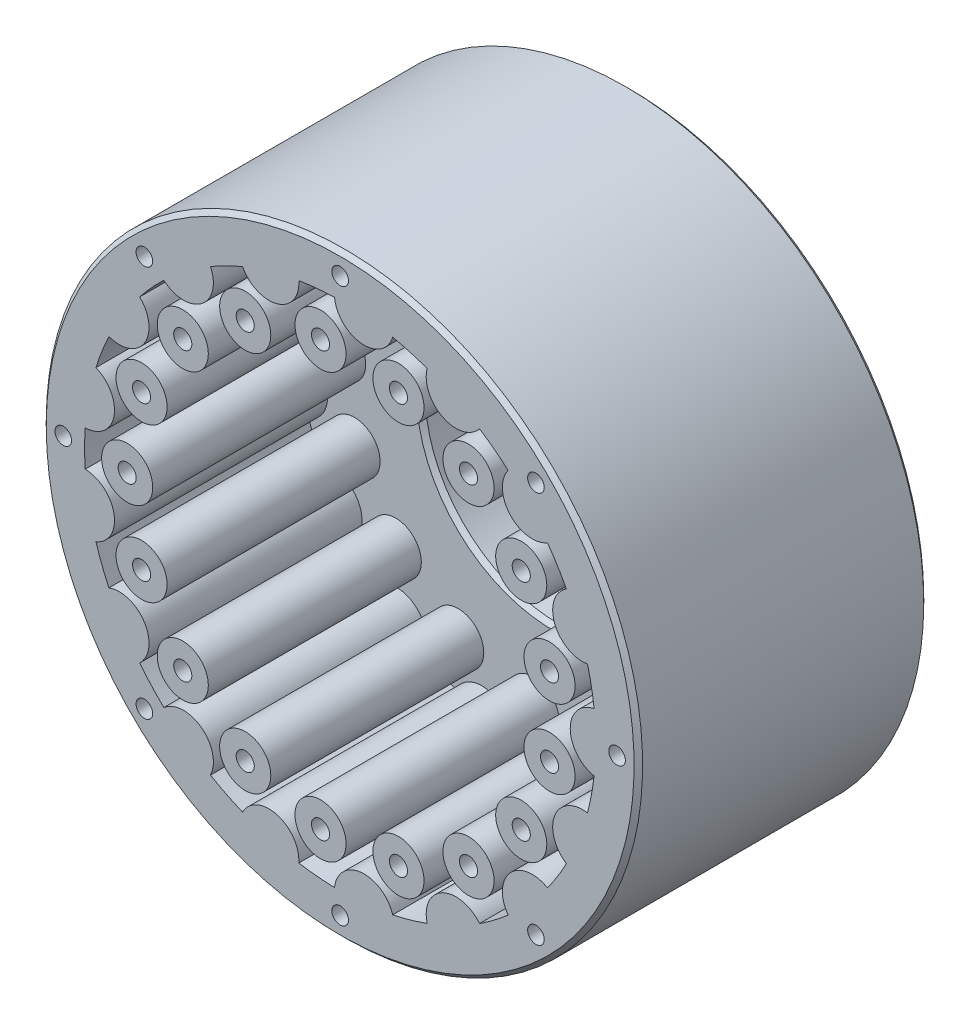
from build123d import *

# Parameters (mm, degrees)
SKETCH3_R                 = 60
HOUSING_BASE_DEPTH        = 9
SKETCH2_R                 = 6
ROLLERS_DEPTH             = 50
ROLLER_BODY_PATTERN_COUNT = 17
SKETCH10_R                = 2.125
DOWEL_HOLES_DEPTH         = 55
DOWEL_HOLE_PATTERN_COUNT  = 17
SKETCH5_R                 = 3.15
ROLLER_HOLE_DEPTH         = 0.5
CIRPATTERN2_COUNT         = 17
CENTER_START              = -18
SKETCH4_R                 = 31.05
CENTER_HOLE_DEPTH         = 14
SKETCH6_R                 = 18
OUTPUTSHAFT_HOLE_DEPTH    = 107.282642045
OUTERWALL_START           = -68
SKETCH7_R                 = 70
OUTERWALL_DEPTH           = 68
SKETCH9_W                 = 1.95
SKETCH9_H                 = 50
CIRPATTERN3_COUNT         = 8
SKETCH11_R                = 2.85
BACKTHREADEDINSERTS_DEPTH = 6
CHAMFER1_SIZE             = 1


with BuildPart() as part:
    # Sketch3 → Housing Base (new, symmetric)
    with BuildSketch(Plane.XY):
        Circle(SKETCH3_R)
    extrude(amount=HOUSING_BASE_DEPTH, both=True)


with BuildPart() as body_2:
    # Sketch2 → Rollers (new body)
    with BuildSketch(Plane.XY.offset(9)):
        with Locations((-50, 0)):
            Circle(SKETCH2_R)
    rollers = extrude(amount=ROLLERS_DEPTH)


with BuildPart() as roller_body_pattern_1:
    # Roller Body Pattern: pattern copy
    add(rollers.rotate(Axis((0, 0, 0), (0, 0, 1)), 1 * 360 / ROLLER_BODY_PATTERN_COUNT))


with BuildPart() as roller_body_pattern_2:
    # Roller Body Pattern: pattern copy
    add(rollers.rotate(Axis((0, 0, 0), (0, 0, 1)), 2 * 360 / ROLLER_BODY_PATTERN_COUNT))


with BuildPart() as roller_body_pattern_3:
    # Roller Body Pattern: pattern copy
    add(rollers.rotate(Axis((0, 0, 0), (0, 0, 1)), 3 * 360 / ROLLER_BODY_PATTERN_COUNT))


with BuildPart() as roller_body_pattern_4:
    # Roller Body Pattern: pattern copy
    add(rollers.rotate(Axis((0, 0, 0), (0, 0, 1)), 4 * 360 / ROLLER_BODY_PATTERN_COUNT))


with BuildPart() as roller_body_pattern_5:
    # Roller Body Pattern: pattern copy
    add(rollers.rotate(Axis((0, 0, 0), (0, 0, 1)), 5 * 360 / ROLLER_BODY_PATTERN_COUNT))


with BuildPart() as roller_body_pattern_6:
    # Roller Body Pattern: pattern copy
    add(rollers.rotate(Axis((0, 0, 0), (0, 0, 1)), 6 * 360 / ROLLER_BODY_PATTERN_COUNT))


with BuildPart() as roller_body_pattern_7:
    # Roller Body Pattern: pattern copy
    add(rollers.rotate(Axis((0, 0, 0), (0, 0, 1)), 7 * 360 / ROLLER_BODY_PATTERN_COUNT))


with BuildPart() as roller_body_pattern_8:
    # Roller Body Pattern: pattern copy
    add(rollers.rotate(Axis((0, 0, 0), (0, 0, 1)), 8 * 360 / ROLLER_BODY_PATTERN_COUNT))


with BuildPart() as roller_body_pattern_9:
    # Roller Body Pattern: pattern copy
    add(rollers.rotate(Axis((0, 0, 0), (0, 0, 1)), 9 * 360 / ROLLER_BODY_PATTERN_COUNT))


with BuildPart() as roller_body_pattern_10:
    # Roller Body Pattern: pattern copy
    add(rollers.rotate(Axis((0, 0, 0), (0, 0, 1)), 10 * 360 / ROLLER_BODY_PATTERN_COUNT))


with BuildPart() as roller_body_pattern_11:
    # Roller Body Pattern: pattern copy
    add(rollers.rotate(Axis((0, 0, 0), (0, 0, 1)), 11 * 360 / ROLLER_BODY_PATTERN_COUNT))


with BuildPart() as roller_body_pattern_12:
    # Roller Body Pattern: pattern copy
    add(rollers.rotate(Axis((0, 0, 0), (0, 0, 1)), 12 * 360 / ROLLER_BODY_PATTERN_COUNT))


with BuildPart() as roller_body_pattern_13:
    # Roller Body Pattern: pattern copy
    add(rollers.rotate(Axis((0, 0, 0), (0, 0, 1)), 13 * 360 / ROLLER_BODY_PATTERN_COUNT))


with BuildPart() as roller_body_pattern_14:
    # Roller Body Pattern: pattern copy
    add(rollers.rotate(Axis((0, 0, 0), (0, 0, 1)), 14 * 360 / ROLLER_BODY_PATTERN_COUNT))


with BuildPart() as roller_body_pattern_15:
    # Roller Body Pattern: pattern copy
    add(rollers.rotate(Axis((0, 0, 0), (0, 0, 1)), 15 * 360 / ROLLER_BODY_PATTERN_COUNT))


with BuildPart() as roller_body_pattern_16:
    # Roller Body Pattern: pattern copy
    add(rollers.rotate(Axis((0, 0, 0), (0, 0, 1)), 16 * 360 / ROLLER_BODY_PATTERN_COUNT))


with BuildPart() as dowel_holes_tool:
    # Sketch10 → Dowel Holes (new body)
    with BuildSketch(Plane.XY.offset(59)):
        with Locations((-50, 0)):
            Circle(SKETCH10_R)
    dowel_holes = extrude(amount=-DOWEL_HOLES_DEPTH)


with BuildPart() as part_1:
    add(part.part)

    # Dowel Holes: cut by dowel_holes_tool
    add(dowel_holes_tool.part, mode=Mode.SUBTRACT)


with BuildPart() as body_2_1:
    add(body_2.part)

    # Dowel Holes: cut by dowel_holes_tool
    add(dowel_holes_tool.part, mode=Mode.SUBTRACT)


with BuildPart() as dowel_hole_pattern_tool:
    # Dowel Hole Pattern: Dowel Holes ×17 about axis
    dowel_hole_pattern_axis = Axis((0, 0, 0), (0, 0, 1))
    for i in range(1, DOWEL_HOLE_PATTERN_COUNT):
        add(dowel_holes.rotate(dowel_hole_pattern_axis, i * 360 / DOWEL_HOLE_PATTERN_COUNT))


with BuildPart() as part_2:
    add(part_1.part)

    # Dowel Hole Pattern: cut by dowel_hole_pattern_tool
    add(dowel_hole_pattern_tool.part, mode=Mode.SUBTRACT)

    # Sketch5 → Roller Hole (cut)
    with BuildSketch(Plane.XY.offset(9)):
        with Locations((-50, 0)):
            Circle(SKETCH5_R)
    roller_hole = extrude(amount=-ROLLER_HOLE_DEPTH, mode=Mode.SUBTRACT)

    # CirPattern2: Roller Hole ×17 about axis
    cirpattern2_axis = Axis((0, 0, 0), (0, 0, 1))
    for i in range(1, CIRPATTERN2_COUNT):
        add(roller_hole.rotate(cirpattern2_axis, i * 360 / CIRPATTERN2_COUNT), mode=Mode.SUBTRACT)

    # Sketch4 → Center Hole (cut)
    with BuildSketch(Plane(origin=(0, 0, -9), x_dir=(-1, 0, 0), z_dir=(0, 0, -1)).offset(CENTER_START)):
        with Locations(Location((0, 0, 0), (0, 0, 180))):
            Circle(SKETCH4_R)
    extrude(amount=CENTER_HOLE_DEPTH, mode=Mode.SUBTRACT)

    # Sketch6 → OutputShaft Hole (cut, through all)
    with BuildSketch(Plane.XY.offset(-5)):
        Circle(SKETCH6_R)
    extrude(amount=-OUTPUTSHAFT_HOLE_DEPTH, mode=Mode.SUBTRACT)

    # Sketch7 → OuterWall (add)
    # profile 1 of 18: a face of its own
    with BuildSketch(Plane(origin=(0, 0, -9), x_dir=(-1, 0, 0), z_dir=(0, 0, -1)).offset(OUTERWALL_START)):
        Circle(SKETCH7_R)
        with BuildLine():
            ThreePointArc((-12.329319454, 58.719569837), (-5.536101568, 59.744050578), (1.329696717, 59.985264079))
            ThreePointArc((1.329696717, 59.985264079), (5.536101568, 59.744050578), (9.715207247, 59.208232098))
            ThreePointArc((9.715207247, 59.208232098), (16.419779404, 57.70953859), (22.909082005, 55.45425107))
            ThreePointArc((22.909082005, 55.45425107), (26.744301347, 53.709797481), (30.447641376, 51.70049453))
            ThreePointArc((30.447641376, 51.70049453), (36.158078183, 47.881033637), (41.394468824, 43.433834171))
            ThreePointArc((41.394468824, 43.433834171), (44.340535033, 40.421738619), (47.06795282, 37.210318694))
            ThreePointArc((47.06795282, 37.210318694), (51.013028144, 31.585929773), (54.289303254, 25.547437292))
            ThreePointArc((54.289303254, 25.547437292), (55.948333764, 21.674499971), (57.331476424, 17.694683128))
            ThreePointArc((57.331476424, 17.694683128), (58.978385981, 11.024971069), (59.852066452, 4.210717443))
            ThreePointArc((59.852066452, 4.210717443), (59.963005208, 2.106657644), (60, 0))
            ThreePointArc((60, 0), (59.963005208, -2.106657644), (59.852066452, -4.210717443))
            ThreePointArc((59.852066452, -4.210717443), (58.978385981, -11.024971069), (57.331476424, -17.694683128))
            ThreePointArc((57.331476424, -17.694683128), (55.948333764, -21.674499971), (54.289303254, -25.547437292))
            ThreePointArc((54.289303254, -25.547437292), (51.013028144, -31.585929773), (47.06795282, -37.210318694))
            ThreePointArc((47.06795282, -37.210318694), (44.340535033, -40.421738619), (41.394468824, -43.433834171))
            ThreePointArc((41.394468824, -43.433834171), (36.158078183, -47.881033637), (30.447641376, -51.70049453))
            ThreePointArc((30.447641376, -51.70049453), (26.744301347, -53.709797481), (22.909082005, -55.45425107))
            ThreePointArc((22.909082005, -55.45425107), (16.419779404, -57.70953859), (9.715207247, -59.208232098))
            ThreePointArc((9.715207247, -59.208232098), (5.536101568, -59.744050578), (1.329696717, -59.985264079))
            ThreePointArc((1.329696717, -59.985264079), (-5.536101568, -59.744050578), (-12.329319454, -58.719569837))
            ThreePointArc((-12.329319454, -58.719569837), (-16.419779404, -57.70953859), (-20.42927148, -56.414934785))
            ThreePointArc((-20.42927148, -56.414934785), (-26.744301347, -53.709797481), (-32.708703244, -50.300504293))
            ThreePointArc((-32.708703244, -50.300504293), (-36.158078183, -47.881033637), (-39.429153362, -45.225455942))
            ThreePointArc((-39.429153362, -45.225455942), (-44.340535033, -40.421738619), (-48.670595416, -35.088076919))
            ThreePointArc((-48.670595416, -35.088076919), (-51.013028144, -31.585929773), (-53.103909597, -27.928028671))
            ThreePointArc((-53.103909597, -27.928028671), (-55.948333764, -21.674499971), (-58.059253983, -15.136810328))
            ThreePointArc((-58.059253983, -15.136810328), (-58.978385981, -11.024971069), (-59.606688583, -6.858766374))
            ThreePointArc((-59.606688583, -6.858766374), (-60, 0), (-59.606688583, 6.858766374))
            ThreePointArc((-59.606688583, 6.858766374), (-58.978385981, 11.024971069), (-58.059253983, 15.136810328))
            ThreePointArc((-58.059253983, 15.136810328), (-55.948333764, 21.674499971), (-53.103909597, 27.928028671))
            ThreePointArc((-53.103909597, 27.928028671), (-51.013028144, 31.585929773), (-48.670595416, 35.088076919))
            ThreePointArc((-48.670595416, 35.088076919), (-44.340535033, 40.421738619), (-39.429153362, 45.225455942))
            ThreePointArc((-39.429153362, 45.225455942), (-36.158078183, 47.881033637), (-32.708703244, 50.300504293))
            ThreePointArc((-32.708703244, 50.300504293), (-26.744301347, 53.709797481), (-20.42927148, 56.414934785))
            ThreePointArc((-20.42927148, 56.414934785), (-16.419779404, 57.70953859), (-12.329319454, 58.719569837))
        make_face(mode=Mode.SUBTRACT)
    # profile 2 of 18: a face of its own
    with BuildSketch(Plane(origin=(0, 0, -9), x_dir=(-1, 0, 0), z_dir=(0, 0, -1)).offset(OUTERWALL_START)):
        with BuildLine():
            ThreePointArc((41.394468824, 43.433834171), (36.158078183, 47.881033637), (30.447641376, 51.70049453))
            ThreePointArc((30.447641376, 51.70049453), (32.545724956, 43.097504891), (41.394468824, 43.433834171))
        make_face()
    # profile 3 of 18: a face of its own
    with BuildSketch(Plane(origin=(0, 0, -9), x_dir=(-1, 0, 0), z_dir=(0, 0, -1)).offset(OUTERWALL_START)):
        with BuildLine():
            ThreePointArc((22.909082005, 55.45425107), (16.419779404, 57.70953859), (9.715207247, 59.208232098))
            ThreePointArc((9.715207247, 59.208232098), (14.779370232, 51.944098378), (22.909082005, 55.45425107))
        make_face()
    # profile 4 of 18: a face of its own
    with BuildSketch(Plane(origin=(0, 0, -9), x_dir=(-1, 0, 0), z_dir=(0, 0, -1)).offset(OUTERWALL_START)):
        with BuildLine():
            ThreePointArc((-12.329319454, 58.719569837), (-4.983020338, 53.775353547), (1.329696717, 59.985264079))
            ThreePointArc((1.329696717, 59.985264079), (-5.536101568, 59.744050578), (-12.329319454, 58.719569837))
        make_face()
    # profile 5 of 18: a face of its own
    with BuildSketch(Plane(origin=(0, 0, -9), x_dir=(-1, 0, 0), z_dir=(0, 0, -1)).offset(OUTERWALL_START)):
        with BuildLine():
            ThreePointArc((-32.708703244, 50.300504293), (-24.072426398, 48.343949239), (-20.42927148, 56.414934785))
            ThreePointArc((-20.42927148, 56.414934785), (-26.744301347, 53.709797481), (-32.708703244, 50.300504293))
        make_face()
    # profile 6 of 18: a face of its own
    with BuildSketch(Plane(origin=(0, 0, -9), x_dir=(-1, 0, 0), z_dir=(0, 0, -1)).offset(OUTERWALL_START)):
        with BuildLine():
            ThreePointArc((-48.670595416, 35.088076919), (-39.910717884, 36.383426704), (-39.429153362, 45.225455942))
            ThreePointArc((-39.429153362, 45.225455942), (-44.340535033, 40.421738619), (-48.670595416, 35.088076919))
        make_face()
    # profile 7 of 18: a face of its own
    with BuildSketch(Plane(origin=(0, 0, -9), x_dir=(-1, 0, 0), z_dir=(0, 0, -1)).offset(OUTERWALL_START)):
        with BuildLine():
            ThreePointArc((-58.059253983, 15.136810328), (-50.358845767, 19.509120785), (-53.103909597, 27.928028671))
            ThreePointArc((-53.103909597, 27.928028671), (-55.948333764, 21.674499971), (-58.059253983, 15.136810328))
        make_face()
    # profile 8 of 18: a face of its own
    with BuildSketch(Plane(origin=(0, 0, -9), x_dir=(-1, 0, 0), z_dir=(0, 0, -1)).offset(OUTERWALL_START)):
        with BuildLine():
            ThreePointArc((-59.606688583, -6.858766374), (-54.005732481, 0), (-59.606688583, 6.858766374))
            ThreePointArc((-59.606688583, 6.858766374), (-60, 0), (-59.606688583, -6.858766374))
        make_face()
    # profile 9 of 18: a face of its own
    with BuildSketch(Plane(origin=(0, 0, -9), x_dir=(-1, 0, 0), z_dir=(0, 0, -1)).offset(OUTERWALL_START)):
        with BuildLine():
            ThreePointArc((-53.103909597, -27.928028671), (-50.358845767, -19.509120785), (-58.059253983, -15.136810328))
            ThreePointArc((-58.059253983, -15.136810328), (-55.948333764, -21.674499971), (-53.103909597, -27.928028671))
        make_face()
    # profile 10 of 18: a face of its own
    with BuildSketch(Plane(origin=(0, 0, -9), x_dir=(-1, 0, 0), z_dir=(0, 0, -1)).offset(OUTERWALL_START)):
        with BuildLine():
            ThreePointArc((-39.429153362, -45.225455942), (-39.910717884, -36.383426704), (-48.670595416, -35.088076919))
            ThreePointArc((-48.670595416, -35.088076919), (-44.340535033, -40.421738619), (-39.429153362, -45.225455942))
        make_face()
    # profile 11 of 18: a face of its own
    with BuildSketch(Plane(origin=(0, 0, -9), x_dir=(-1, 0, 0), z_dir=(0, 0, -1)).offset(OUTERWALL_START)):
        with BuildLine():
            ThreePointArc((-20.42927148, -56.414934785), (-24.072426398, -48.343949239), (-32.708703244, -50.300504293))
            ThreePointArc((-32.708703244, -50.300504293), (-26.744301347, -53.709797481), (-20.42927148, -56.414934785))
        make_face()
    # profile 12 of 18: a face of its own
    with BuildSketch(Plane(origin=(0, 0, -9), x_dir=(-1, 0, 0), z_dir=(0, 0, -1)).offset(OUTERWALL_START)):
        with BuildLine():
            ThreePointArc((1.329696717, -59.985264079), (-4.983020338, -53.775353547), (-12.329319454, -58.719569837))
            ThreePointArc((-12.329319454, -58.719569837), (-5.536101568, -59.744050578), (1.329696717, -59.985264079))
        make_face()
    # profile 13 of 18: a face of its own
    with BuildSketch(Plane(origin=(0, 0, -9), x_dir=(-1, 0, 0), z_dir=(0, 0, -1)).offset(OUTERWALL_START)):
        with BuildLine():
            ThreePointArc((9.715207247, -59.208232098), (16.419779404, -57.70953859), (22.909082005, -55.45425107))
            ThreePointArc((22.909082005, -55.45425107), (14.779370232, -51.944098378), (9.715207247, -59.208232098))
        make_face()
    # profile 14 of 18: a face of its own
    with BuildSketch(Plane(origin=(0, 0, -9), x_dir=(-1, 0, 0), z_dir=(0, 0, -1)).offset(OUTERWALL_START)):
        with BuildLine():
            ThreePointArc((30.447641376, -51.70049453), (36.158078183, -47.881033637), (41.394468824, -43.433834171))
            ThreePointArc((41.394468824, -43.433834171), (32.545724956, -43.097504891), (30.447641376, -51.70049453))
        make_face()
    # profile 15 of 18: a face of its own
    with BuildSketch(Plane(origin=(0, 0, -9), x_dir=(-1, 0, 0), z_dir=(0, 0, -1)).offset(OUTERWALL_START)):
        with BuildLine():
            ThreePointArc((47.06795282, -37.210318694), (51.013028144, -31.585929773), (54.289303254, -25.547437292))
            ThreePointArc((54.289303254, -25.547437292), (45.916599183, -28.430354558), (47.06795282, -37.210318694))
        make_face()
    # profile 16 of 18: a face of its own
    with BuildSketch(Plane(origin=(0, 0, -9), x_dir=(-1, 0, 0), z_dir=(0, 0, -1)).offset(OUTERWALL_START)):
        with BuildLine():
            ThreePointArc((57.331476424, -17.694683128), (58.978385981, -11.024971069), (59.852066452, -4.210717443))
            ThreePointArc((59.852066452, -4.210717443), (53.086182257, -9.923527303), (57.331476424, -17.694683128))
        make_face()
    # profile 17 of 18: a face of its own
    with BuildSketch(Plane(origin=(0, 0, -9), x_dir=(-1, 0, 0), z_dir=(0, 0, -1)).offset(OUTERWALL_START)):
        with BuildLine():
            ThreePointArc((59.852066452, 4.210717443), (58.978385981, 11.024971069), (57.331476424, 17.694683128))
            ThreePointArc((57.331476424, 17.694683128), (53.086182257, 9.923527303), (59.852066452, 4.210717443))
        make_face()
    # profile 18 of 18: a face of its own
    with BuildSketch(Plane(origin=(0, 0, -9), x_dir=(-1, 0, 0), z_dir=(0, 0, -1)).offset(OUTERWALL_START)):
        with BuildLine():
            ThreePointArc((54.289303254, 25.547437292), (51.013028144, 31.585929773), (47.06795282, 37.210318694))
            ThreePointArc((47.06795282, 37.210318694), (45.916599183, 28.430354558), (54.289303254, 25.547437292))
        make_face()
    extrude(amount=OUTERWALL_DEPTH)

    # Sketch9 → Ø4.0mm Screw Hole1 (revolve, cut)
    with BuildSketch(Plane(origin=(-65, 0, 59), x_dir=(0, -1, 0), z_dir=(1, 0, 0))):
        with Locations((0.975, 25)):
            Rectangle(SKETCH9_W, SKETCH9_H)
    f_4_0mm_screw_hole1 = revolve(axis=Axis((-65, 0, 65.35), (0, 0, -1)), mode=Mode.SUBTRACT)

    # CirPattern3: Ø4.0mm Screw Hole1 ×8 about axis
    cirpattern3_axis = Axis((0, 0, 0), (0, 0, 1))
    for i in range(1, CIRPATTERN3_COUNT):
        add(f_4_0mm_screw_hole1.rotate(cirpattern3_axis, i * 360 / CIRPATTERN3_COUNT), mode=Mode.SUBTRACT)

    # Sketch11 → BackThreadedInserts (cut)
    with BuildSketch(Plane(origin=(0, 0, -9), x_dir=(-1, 0, 0), z_dir=(0, 0, -1))):
        with Locations((-12.5, 36)):
            Circle(SKETCH11_R)
        with Locations((12.5, 36)):
            Circle(SKETCH11_R)
        with Locations((36, 12.5)):
            Circle(SKETCH11_R)
        with Locations((36, -12.5)):
            Circle(SKETCH11_R)
        with Locations((12.5, -36)):
            Circle(SKETCH11_R)
        with Locations((-12.5, -36)):
            Circle(SKETCH11_R)
        with Locations((-36, -12.5)):
            Circle(SKETCH11_R)
        with Locations((-36, 12.5)):
            Circle(SKETCH11_R)
        with Locations((-36, 0)):
            Circle(SKETCH11_R)
        with Locations((0, 36)):
            Circle(SKETCH11_R)
        with Locations((36, 0)):
            Circle(SKETCH11_R)
        with Locations((0, -36)):
            Circle(SKETCH11_R)
    extrude(amount=-BACKTHREADEDINSERTS_DEPTH, mode=Mode.SUBTRACT)

    # Chamfer1
    chamfer1_edges = [part_2.edges().sort_by_distance(p)[0] for p in [
        (-31.05, 0, 9),
        (-18, 0, -9),
        (-18, 0, -5),
        (70, 0, -9),
        (70, 0, 59),
    ]]
    chamfer(chamfer1_edges, length=CHAMFER1_SIZE)


with BuildPart() as roller_body_pattern_1_1:
    add(roller_body_pattern_1.part)

    # Dowel Hole Pattern: cut by dowel_hole_pattern_tool
    add(dowel_hole_pattern_tool.part, mode=Mode.SUBTRACT)


with BuildPart() as roller_body_pattern_2_1:
    add(roller_body_pattern_2.part)

    # Dowel Hole Pattern: cut by dowel_hole_pattern_tool
    add(dowel_hole_pattern_tool.part, mode=Mode.SUBTRACT)


with BuildPart() as roller_body_pattern_3_1:
    add(roller_body_pattern_3.part)

    # Dowel Hole Pattern: cut by dowel_hole_pattern_tool
    add(dowel_hole_pattern_tool.part, mode=Mode.SUBTRACT)


with BuildPart() as roller_body_pattern_4_1:
    add(roller_body_pattern_4.part)

    # Dowel Hole Pattern: cut by dowel_hole_pattern_tool
    add(dowel_hole_pattern_tool.part, mode=Mode.SUBTRACT)


with BuildPart() as roller_body_pattern_5_1:
    add(roller_body_pattern_5.part)

    # Dowel Hole Pattern: cut by dowel_hole_pattern_tool
    add(dowel_hole_pattern_tool.part, mode=Mode.SUBTRACT)


with BuildPart() as roller_body_pattern_6_1:
    add(roller_body_pattern_6.part)

    # Dowel Hole Pattern: cut by dowel_hole_pattern_tool
    add(dowel_hole_pattern_tool.part, mode=Mode.SUBTRACT)


with BuildPart() as roller_body_pattern_7_1:
    add(roller_body_pattern_7.part)

    # Dowel Hole Pattern: cut by dowel_hole_pattern_tool
    add(dowel_hole_pattern_tool.part, mode=Mode.SUBTRACT)


with BuildPart() as roller_body_pattern_8_1:
    add(roller_body_pattern_8.part)

    # Dowel Hole Pattern: cut by dowel_hole_pattern_tool
    add(dowel_hole_pattern_tool.part, mode=Mode.SUBTRACT)


with BuildPart() as roller_body_pattern_9_1:
    add(roller_body_pattern_9.part)

    # Dowel Hole Pattern: cut by dowel_hole_pattern_tool
    add(dowel_hole_pattern_tool.part, mode=Mode.SUBTRACT)


with BuildPart() as roller_body_pattern_10_1:
    add(roller_body_pattern_10.part)

    # Dowel Hole Pattern: cut by dowel_hole_pattern_tool
    add(dowel_hole_pattern_tool.part, mode=Mode.SUBTRACT)


with BuildPart() as roller_body_pattern_11_1:
    add(roller_body_pattern_11.part)

    # Dowel Hole Pattern: cut by dowel_hole_pattern_tool
    add(dowel_hole_pattern_tool.part, mode=Mode.SUBTRACT)


with BuildPart() as roller_body_pattern_12_1:
    add(roller_body_pattern_12.part)

    # Dowel Hole Pattern: cut by dowel_hole_pattern_tool
    add(dowel_hole_pattern_tool.part, mode=Mode.SUBTRACT)


with BuildPart() as roller_body_pattern_13_1:
    add(roller_body_pattern_13.part)

    # Dowel Hole Pattern: cut by dowel_hole_pattern_tool
    add(dowel_hole_pattern_tool.part, mode=Mode.SUBTRACT)


with BuildPart() as roller_body_pattern_14_1:
    add(roller_body_pattern_14.part)

    # Dowel Hole Pattern: cut by dowel_hole_pattern_tool
    add(dowel_hole_pattern_tool.part, mode=Mode.SUBTRACT)


with BuildPart() as roller_body_pattern_15_1:
    add(roller_body_pattern_15.part)

    # Dowel Hole Pattern: cut by dowel_hole_pattern_tool
    add(dowel_hole_pattern_tool.part, mode=Mode.SUBTRACT)


with BuildPart() as roller_body_pattern_16_1:
    add(roller_body_pattern_16.part)

    # Dowel Hole Pattern: cut by dowel_hole_pattern_tool
    add(dowel_hole_pattern_tool.part, mode=Mode.SUBTRACT)


solid = Compound([body_2_1.part, part_2.part, roller_body_pattern_1_1.part, roller_body_pattern_2_1.part, roller_body_pattern_3_1.part, roller_body_pattern_4_1.part, roller_body_pattern_5_1.part, roller_body_pattern_6_1.part, roller_body_pattern_7_1.part, roller_body_pattern_8_1.part, roller_body_pattern_9_1.part, roller_body_pattern_10_1.part, roller_body_pattern_11_1.part, roller_body_pattern_12_1.part, roller_body_pattern_13_1.part, roller_body_pattern_14_1.part, roller_body_pattern_15_1.part, roller_body_pattern_16_1.part])
